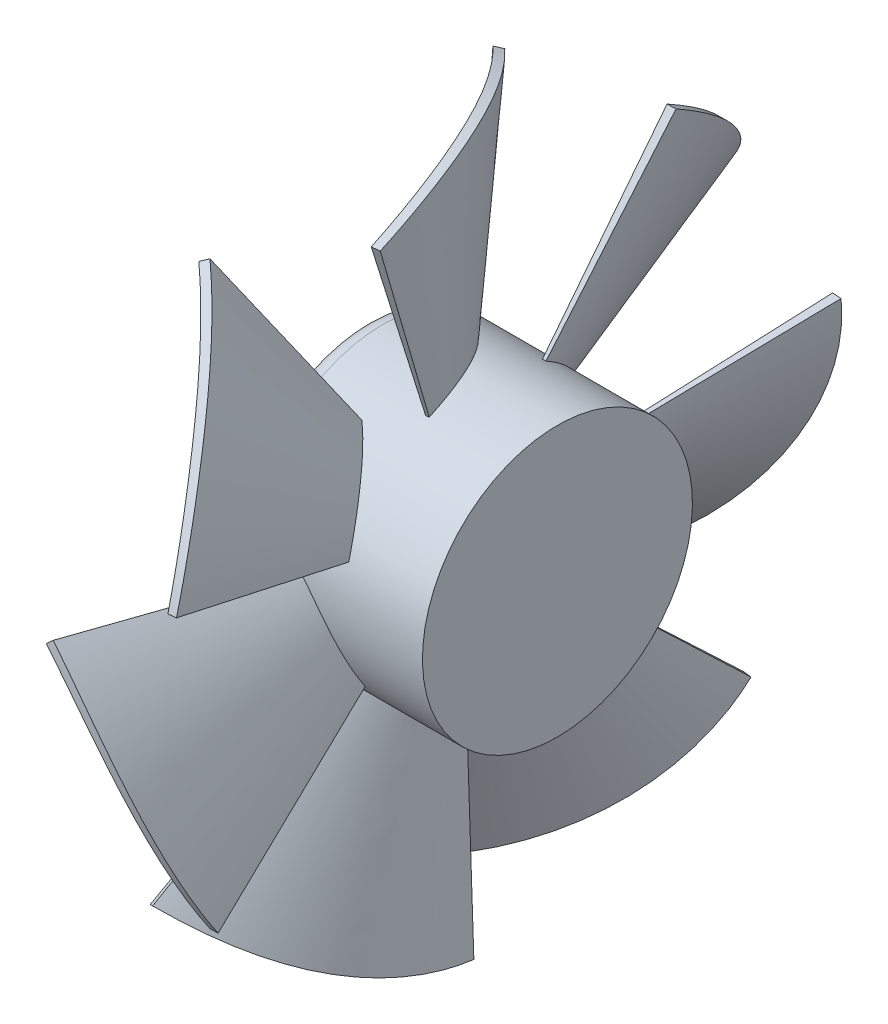
from build123d import *

# Parameters (mm, degrees)
SKETCH5_W                  = 21.4
SKETCH5_H                  = 15
CIRPATTERN1_COUNT          = 7
SKETCH_CUT_BLADE_OUTSIDE_W = 105.131
SKETCH_CUT_BLADE_OUTSIDE_H = 103.447
SKETCH_CUT_BLADE_OUTSIDE_R = 38
CUT_FAN_BLADE_DEPTH        = 63.576805281
COSMETIC_FILLET_R          = 2


with BuildPart() as part:
    # Sketch5 → Body (revolve)
    with BuildSketch(Plane.XY, mode=Mode.PRIVATE) as body_sk:
        with Locations((-14.7, 7.5)):
            Rectangle(SKETCH5_W, SKETCH5_H)
    revolve(body_sk.sketch.rotate(Axis((-25.4, 0, 0), (1, 0, 0)), 180), axis=Axis((-25.4, 0, 0), (1, 0, 0)))

    # Sketch-Blade-Top → Loft-Fan-Blade section 0
    with BuildSketch(Plane(origin=(0, 38, 0), x_dir=(-1, 0, 0), z_dir=(0, 1, 0)), mode=Mode.PRIVATE) as loft_fan_blade_s0:
        with BuildLine():
            Line((10.78352818, 14.61647182), (9.787333481, 14.529316078))
            ThreePointArc((9.787333481, 14.529316078), (13.793692213, -0.422618262), (22.672300675, -13.102585239))
            Line((22.672300675, -13.102585239), (23.379407456, -12.395478458))
            ThreePointArc((23.379407456, -12.395478458), (14.7, 0), (10.78352818, 14.61647182))
        make_face()
    loft_fan_blade = loft([loft_fan_blade_s0.sketch, Vertex(-14.7, 0, 0)])

    # CirPattern1: Loft-Fan-Blade ×7 about axis
    cirpattern1_axis = Axis((-25.4, 0, 0), (1, 0, 0))
    for i in range(1, CIRPATTERN1_COUNT):
        add(loft_fan_blade.rotate(cirpattern1_axis, i * 360 / CIRPATTERN1_COUNT))

    # Sketch-Cut-Blade outside → Cut-Fan-Blade (cut, through all)
    with BuildSketch(Plane(origin=(0, 0, 0), x_dir=(0, 0, -1), z_dir=(1, 0, 0))):
        with Locations((0.1685, -1.2895)):
            Rectangle(SKETCH_CUT_BLADE_OUTSIDE_W, SKETCH_CUT_BLADE_OUTSIDE_H)
        Circle(SKETCH_CUT_BLADE_OUTSIDE_R, mode=Mode.SUBTRACT)
    extrude(amount=-CUT_FAN_BLADE_DEPTH, mode=Mode.SUBTRACT)

    # Cosmetic-Fillet
    cosmetic_fillet_edges = [part.edges().sort_by_distance(p)[0] for p in [
        (-25.4, 15, 0),
    ]]
    fillet(cosmetic_fillet_edges, radius=COSMETIC_FILLET_R)


solid = part.part
